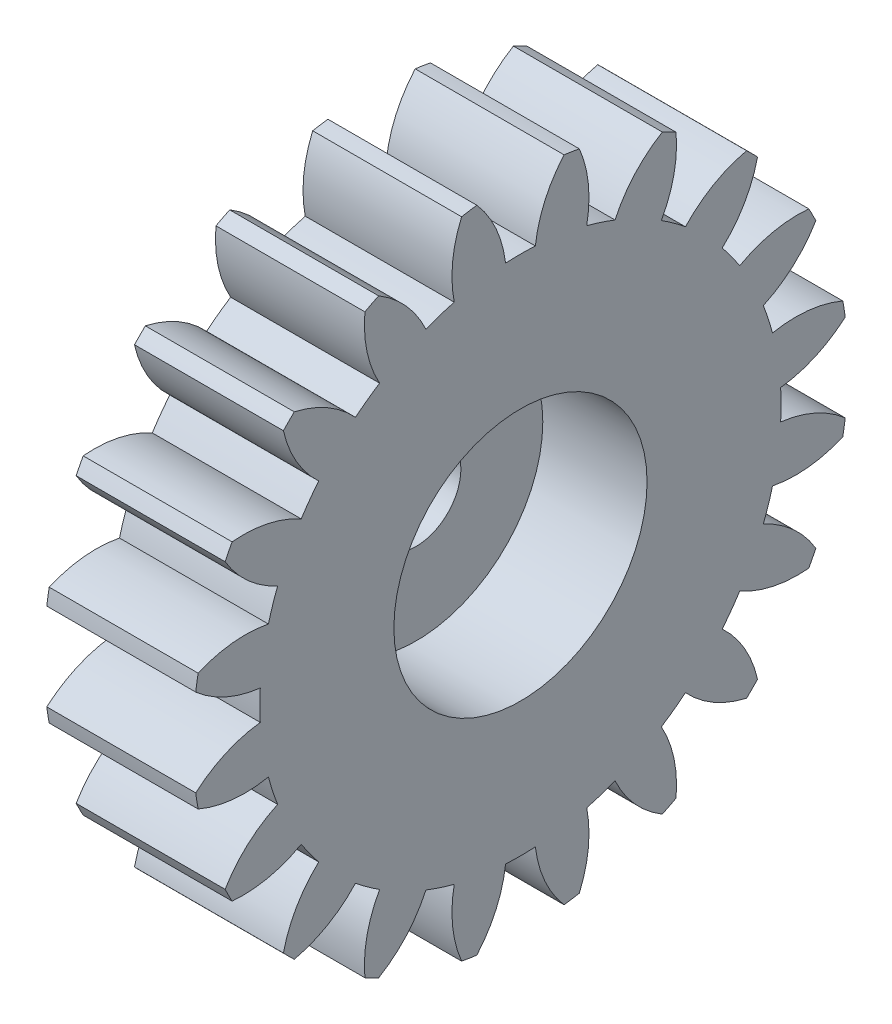
from build123d import *

# Parameters (mm, degrees)
BASPROSKE_W        = 5
BASPROSKE_H        = 11
TOOTHCUT_DEPTH     = 17.340134638
TEETHCUTS_COUNT    = 20
TEETHCUTS_ANGLE    = 342
BORSKE_R           = 1.5
BORE_DEPTH         = 50.0000508
SKETCH1_R          = 4.25
CUT_EXTRUDE1_DEPTH = 3.5


with BuildPart() as part:
    # BasProSke → Base-Revolve (revolve)
    with BuildSketch(Plane(origin=(0, 0, 0), x_dir=(1, 0, 0), z_dir=(0, 1, 0)), mode=Mode.PRIVATE) as base_revolve_sk:
        with Locations((2.5, 5.5)):
            Rectangle(BASPROSKE_W, BASPROSKE_H)
    revolve(base_revolve_sk.sketch.rotate(Axis((-10, 0, 0), (1, 0, 0)), 180), axis=Axis((-10, 0, 0), (1, 0, 0)))

    # TooCutSke → ToothCut (cut, through all)
    with BuildSketch(Plane(origin=(0, 0, 0), x_dir=(0, 0, -1), z_dir=(1, 0, 0))):
        with BuildLine():
            ThreePointArc((0.499924007, 8.734705318), (0, 8.749), (-0.499924007, 8.734705318))
            ThreePointArc((-0.499924007, 8.734705318), (-0.824302243, 9.905497836), (-1.485192705, 10.924909509))
            ThreePointArc((-1.485192705, 10.924909509), (0, 11.0254), (1.485192705, 10.924909509))
            ThreePointArc((1.485192705, 10.924909509), (0.824302243, 9.905497836), (0.499924007, 8.734705318))
        make_face()
    toothcut = extrude(amount=TOOTHCUT_DEPTH, mode=Mode.SUBTRACT)

    # TeethCuts: ToothCut ×20 about axis
    teethcuts_axis = Axis((-10, 0, 0), (1, 0, 0))
    for i in range(1, TEETHCUTS_COUNT):
        add(toothcut.rotate(teethcuts_axis, i * TEETHCUTS_ANGLE / (TEETHCUTS_COUNT - 1)), mode=Mode.SUBTRACT)

    # BorSke → Bore (cut, symmetric)
    with BuildSketch(Plane(origin=(0, 0, 0), x_dir=(0, 0, -1), z_dir=(1, 0, 0))):
        with Locations(Location((0, 0, 0), (0, 0, 180))):
            Circle(BORSKE_R)
    extrude(amount=BORE_DEPTH, both=True, mode=Mode.SUBTRACT)

    # Sketch1 → Cut-Extrude1 (cut)
    with BuildSketch(Plane(origin=(5, 0, 0), x_dir=(0, 0, -1), z_dir=(1, 0, 0))):
        Circle(SKETCH1_R)
    extrude(amount=-CUT_EXTRUDE1_DEPTH, mode=Mode.SUBTRACT)


solid = part.part
